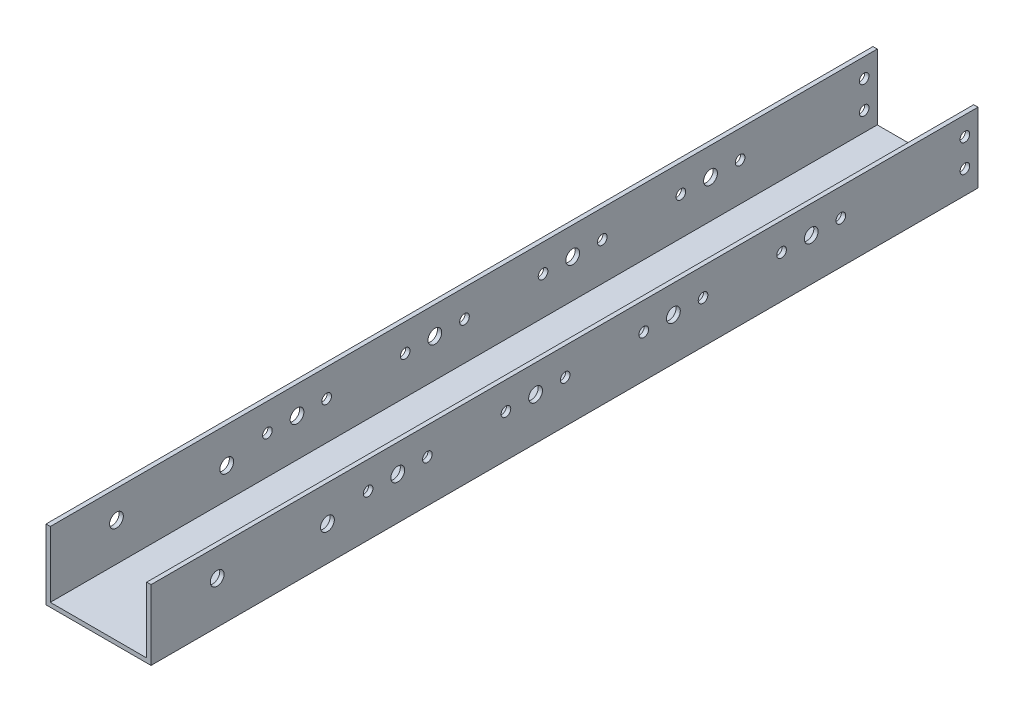
from build123d import *

# Parameters (mm, degrees)
BOSS_EXTRUDE1_DEPTH = 150
SKETCH2_R           = 1.75
SKETCH2_R_2         = 2.5
CUT_EXTRUDE1_DEPTH  = 156.283289507


with BuildPart() as part:
    # Sketch1 → Boss-Extrude1 (new, symmetric)
    with BuildSketch(Plane.XY):
        Polygon((-19.05, 12.7), (-17.4875, 12.7), (-17.4875, -11.1375), (17.4875, -11.1375), (17.4875, 12.7), (19.05, 12.7), (19.05, -12.7), (-19.05, -12.7), align=None)
    extrude(amount=BOSS_EXTRUDE1_DEPTH, both=True)

    # Sketch2 → Cut-Extrude1 (cut, through all)
    with BuildSketch(Plane(origin=(19.05, 0, 0), x_dir=(0, 0, -1), z_dir=(1, 0, 0))):
        with Locations(Location((145.25, 5.78125, 0), (0, 0, 90))):
            Circle(SKETCH2_R)
        with Locations(Location((145.25, -4.21875, 0), (0, 0, 90))):
            Circle(SKETCH2_R)
        with Locations(Location((-86, -0.1375, 0), (0, 0, 90))):
            Circle(SKETCH2_R_2)
        with Locations(Location((-126, 2.7, 0), (0, 0, 90))):
            Circle(SKETCH2_R_2)
        with Locations(Location((-60.5, 2.7, 0), (0, 0, 90))):
            Circle(SKETCH2_R_2)
        with Locations(Location((-71.25, 2.7, 0), (0, 0, 90))):
            Circle(SKETCH2_R)
        with Locations(Location((-49.75, 2.7, 0), (0, 0, 90))):
            Circle(SKETCH2_R)
        with Locations(Location((-21.25, 2.7, 0), (0, 0, 90))):
            Circle(SKETCH2_R)
        with Locations(Location((-10.5, 2.7, 0), (0, 0, 90))):
            Circle(SKETCH2_R_2)
        with Locations(Location((0.25, 2.7, 0), (0, 0, 90))):
            Circle(SKETCH2_R)
        with Locations(Location((28.75, 2.7, 0), (0, 0, 90))):
            Circle(SKETCH2_R)
        with Locations(Location((39.5, 2.7, 0), (0, 0, 90))):
            Circle(SKETCH2_R_2)
        with Locations(Location((50.25, 2.7, 0), (0, 0, 90))):
            Circle(SKETCH2_R)
        with Locations(Location((78.75, 2.7, 0), (0, 0, 90))):
            Circle(SKETCH2_R)
        with Locations(Location((89.5, 2.7, 0), (0, 0, 90))):
            Circle(SKETCH2_R_2)
        with Locations(Location((100.25, 2.7, 0), (0, 0, 90))):
            Circle(SKETCH2_R)
    extrude(amount=-CUT_EXTRUDE1_DEPTH, mode=Mode.SUBTRACT)


solid = part.part
